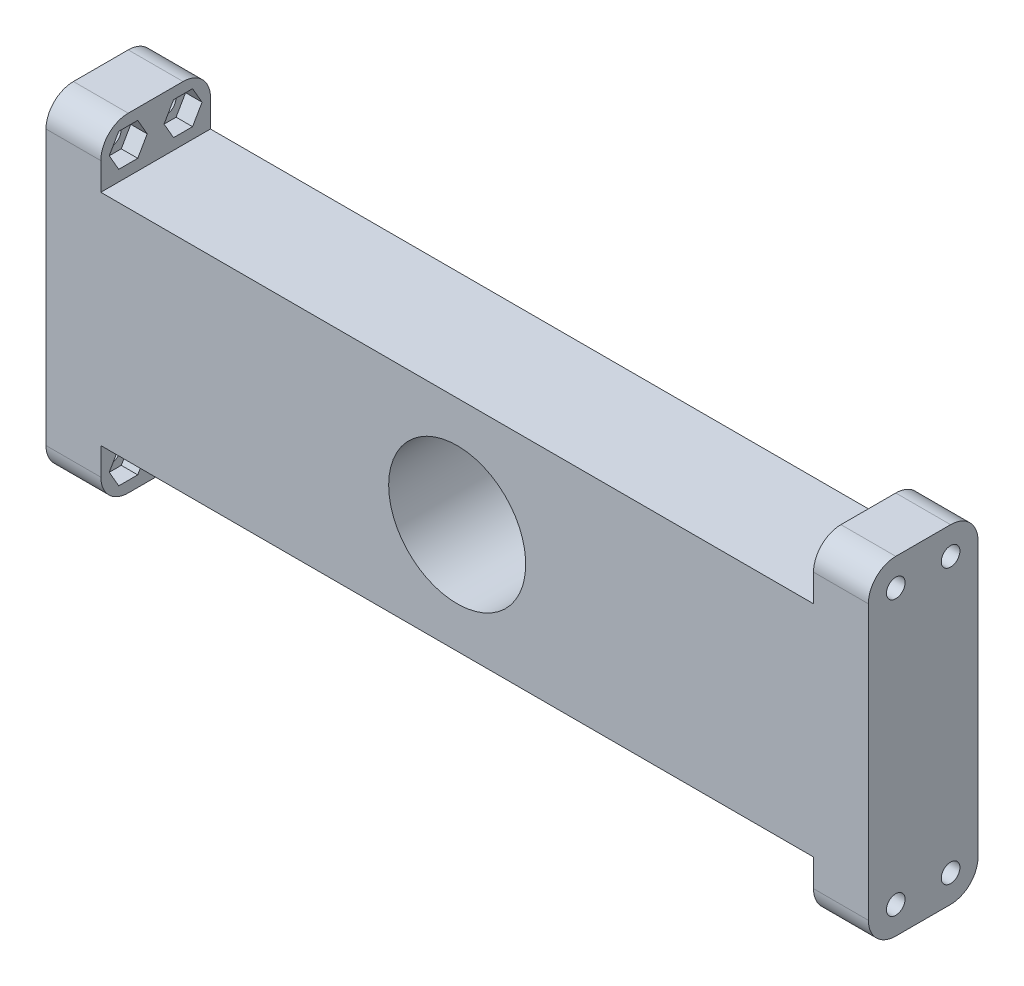
from build123d import *

# Parameters (mm, degrees)
SKETCH1_W                                  = 150
SKETCH1_H                                  = 60
BOSS_EXTRUDE1_DEPTH                        = 10
CUT_EXTRUDE1_DEPTH                         = 84.216584885
CUT_EXTRUDE1_DEPTH_BACK                    = 84.216584885
SKETCH2_W                                  = 130
SKETCH2_H                                  = 10
FILLET1_R                                  = 5
SKETCH4_R                                  = 1.7
CUT_EXTRUDE3_DEPTH                         = 144.527000944
CUT_EXTRUDE4_DEPTH                         = 3
MIRROR1_AT_THE_SECOND_PLANE_COPY_1_SKETC_R = 1.7
MIRROR1_AT_THE_SECOND_PLANE_COPY_1_DEPTH   = 144.527000944
MIRROR1_AT_THE_SECOND_PLANE_COPY_2_DEPTH   = 3
MIRROR2_COPY_1_SKETCH_R                    = 1.7
MIRROR2_COPY_1_DEPTH                       = 144.527000944
MIRROR2_COPY_2_DEPTH                       = 3
MIRROR2_COPY_3_SKETCH_R                    = 1.7
MIRROR2_COPY_3_DEPTH                       = 144.527000944
MIRROR2_COPY_4_DEPTH                       = 3
MIRROR2_COPY_5_SKETCH_R                    = 1.7
MIRROR2_COPY_5_DEPTH                       = 144.527000944
MIRROR2_COPY_6_DEPTH                       = 3
MIRROR2_COPY_7_SKETCH_R                    = 1.7
MIRROR2_COPY_7_DEPTH                       = 144.527000944
SKETCH6_R                                  = 12.5
CUT_EXTRUDE5_DEPTH                         = 84.216584885


with BuildPart() as part:
    # Sketch1 → Boss-Extrude1 (new, symmetric)
    with BuildSketch(Plane.XY):
        Rectangle(SKETCH1_W, SKETCH1_H)
    extrude(amount=BOSS_EXTRUDE1_DEPTH, both=True)

    # Sketch2 → Cut-Extrude1 (cut, two sides: drawn at the far end of the back side and taken through both)
    with BuildSketch(Plane.XY.offset(10).offset(-CUT_EXTRUDE1_DEPTH_BACK)):
        with Locations((0, -25)):
            Rectangle(SKETCH2_W, SKETCH2_H)
        with Locations((0, 25)):
            Rectangle(SKETCH2_W, SKETCH2_H)
    extrude(amount=CUT_EXTRUDE1_DEPTH + CUT_EXTRUDE1_DEPTH_BACK, mode=Mode.SUBTRACT)

    # Fillet1
    fillet1_edges = [part.edges().sort_by_distance(p)[0] for p in [
        (70, -30, -10),
        (-70, 30, -10),
        (-70, -30, 10),
        (-70, 30, 10),
        (70, -30, 10),
        (-70, -30, -10),
        (70, 30, -10),
        (70, 30, 10),
    ]]
    fillet(fillet1_edges, radius=FILLET1_R)

    # Sketch4 → Cut-Extrude3 (cut, symmetric)
    with BuildSketch(Plane.ZY.offset(-65)):
        with Locations((-5, 25)):
            Circle(SKETCH4_R)
    cut_extrude3 = extrude(amount=CUT_EXTRUDE3_DEPTH, both=True, mode=Mode.SUBTRACT)

    # Sketch5 → Cut-Extrude4 (cut)
    with BuildSketch(Plane.ZY.offset(-65)):
        Polygon((-8.464101615, 25), (-6.732050808, 22), (-3.267949192, 22), (-1.535898385, 25), (-3.267949192, 28), (-6.732050808, 28), align=None)
    cut_extrude4 = extrude(amount=-CUT_EXTRUDE4_DEPTH, mode=Mode.SUBTRACT)

    # Mirror1: Cut-Extrude3, Cut-Extrude4 across plane
    add(cut_extrude3.mirror(Plane(origin=(0, 0, 0), x_dir=(0, 0, 1), z_dir=(1, 0, 0))), mode=Mode.SUBTRACT)
    add(cut_extrude4.mirror(Plane(origin=(0, 0, 0), x_dir=(0, 0, 1), z_dir=(1, 0, 0))), mode=Mode.SUBTRACT)

    # Mirror1 at the second plane: Cut-Extrude3, Cut-Extrude4 across plane
    add(cut_extrude3.mirror(Plane.XY), mode=Mode.SUBTRACT)
    add(cut_extrude4.mirror(Plane.XY), mode=Mode.SUBTRACT)

    # Mirror1 at the second plane copy 1 sketc → Mirror1 at the second plane copy 1 (cut, symmetric)
    with BuildSketch(Plane(origin=(-65, 0, 0), x_dir=(0, 0, -1), z_dir=(1, 0, 0))):
        with Locations((-5, 25)):
            Circle(MIRROR1_AT_THE_SECOND_PLANE_COPY_1_SKETC_R)
    extrude(amount=MIRROR1_AT_THE_SECOND_PLANE_COPY_1_DEPTH, both=True, mode=Mode.SUBTRACT)

    # Mirror1 at the second plane copy 2 sketc → Mirror1 at the second plane copy 2 (cut)
    with BuildSketch(Plane(origin=(-65, 0, 0), x_dir=(0, 0, -1), z_dir=(1, 0, 0))):
        Polygon((-8.464101615, 25), (-6.732050808, 22), (-3.267949192, 22), (-1.535898385, 25), (-3.267949192, 28), (-6.732050808, 28), align=None)
    extrude(amount=-MIRROR1_AT_THE_SECOND_PLANE_COPY_2_DEPTH, mode=Mode.SUBTRACT)

    # Mirror2: Cut-Extrude4 across plane
    add(cut_extrude4.mirror(Plane.ZX), mode=Mode.SUBTRACT)

    # Mirror2 copy 1 sketch → Mirror2 copy 1 (cut, symmetric)
    with BuildSketch(Plane(origin=(-65, 0, 0), x_dir=(0, 0, 1), z_dir=(1, 0, 0))):
        with Locations((-5, 25)):
            Circle(MIRROR2_COPY_1_SKETCH_R)
    extrude(amount=MIRROR2_COPY_1_DEPTH, both=True, mode=Mode.SUBTRACT)

    # Mirror2 copy 2 sketch → Mirror2 copy 2 (cut)
    with BuildSketch(Plane(origin=(-65, 0, 0), x_dir=(0, 0, 1), z_dir=(1, 0, 0))):
        Polygon((-8.464101615, 25), (-6.732050808, 22), (-3.267949192, 22), (-1.535898385, 25), (-3.267949192, 28), (-6.732050808, 28), align=None)
    extrude(amount=-MIRROR2_COPY_2_DEPTH, mode=Mode.SUBTRACT)

    # Mirror2 copy 3 sketch → Mirror2 copy 3 (cut, symmetric)
    with BuildSketch(Plane(origin=(65, 0, 0), x_dir=(0, 0, -1), z_dir=(-1, 0, 0))):
        with Locations((-5, 25)):
            Circle(MIRROR2_COPY_3_SKETCH_R)
    extrude(amount=MIRROR2_COPY_3_DEPTH, both=True, mode=Mode.SUBTRACT)

    # Mirror2 copy 4 sketch → Mirror2 copy 4 (cut)
    with BuildSketch(Plane(origin=(65, 0, 0), x_dir=(0, 0, -1), z_dir=(-1, 0, 0))):
        Polygon((-8.464101615, 25), (-6.732050808, 22), (-3.267949192, 22), (-1.535898385, 25), (-3.267949192, 28), (-6.732050808, 28), align=None)
    extrude(amount=-MIRROR2_COPY_4_DEPTH, mode=Mode.SUBTRACT)

    # Mirror2 copy 5 sketch → Mirror2 copy 5 (cut, symmetric)
    with BuildSketch(Plane(origin=(-65, 0, 0), x_dir=(0, 0, -1), z_dir=(1, 0, 0))):
        with Locations((-5, -25)):
            Circle(MIRROR2_COPY_5_SKETCH_R)
    extrude(amount=MIRROR2_COPY_5_DEPTH, both=True, mode=Mode.SUBTRACT)

    # Mirror2 copy 6 sketch → Mirror2 copy 6 (cut)
    with BuildSketch(Plane(origin=(-65, 0, 0), x_dir=(0, 0, -1), z_dir=(1, 0, 0))):
        Polygon((-8.464101615, -25), (-6.732050808, -22), (-3.267949192, -22), (-1.535898385, -25), (-3.267949192, -28), (-6.732050808, -28), align=None)
    extrude(amount=-MIRROR2_COPY_6_DEPTH, mode=Mode.SUBTRACT)

    # Mirror2 copy 7 sketch → Mirror2 copy 7 (cut, symmetric)
    with BuildSketch(Plane.ZY.offset(-65)):
        with Locations((-5, -25)):
            Circle(MIRROR2_COPY_7_SKETCH_R)
    extrude(amount=MIRROR2_COPY_7_DEPTH, both=True, mode=Mode.SUBTRACT)

    # Sketch6 → Cut-Extrude5 (cut, through all)
    with BuildSketch(Plane(origin=(0, 0, -10), x_dir=(-1, 0, 0), z_dir=(0, 0, -1))):
        Circle(SKETCH6_R)
    extrude(amount=-CUT_EXTRUDE5_DEPTH, mode=Mode.SUBTRACT)


solid = part.part
